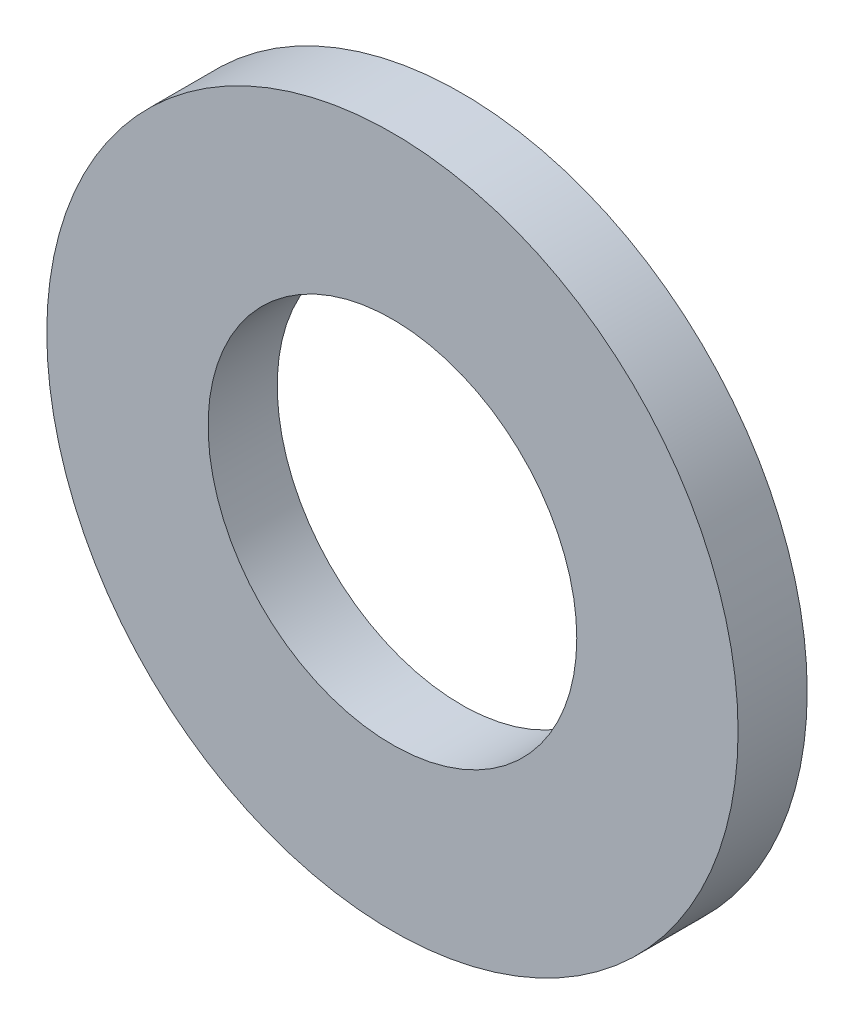
from build123d import *

# Parameters (mm, degrees)
ESQUISSE1_R        = 6
ESQUISSE1_R_2      = 3.2
BOSS_EXTRU_1_DEPTH = 1.2


with BuildPart() as part:
    # Esquisse1 → Boss.-Extru.1 (new body)
    with BuildSketch(Plane.XY):
        Circle(ESQUISSE1_R)
        Circle(ESQUISSE1_R_2, mode=Mode.SUBTRACT)
    extrude(amount=BOSS_EXTRU_1_DEPTH)


solid = part.part
